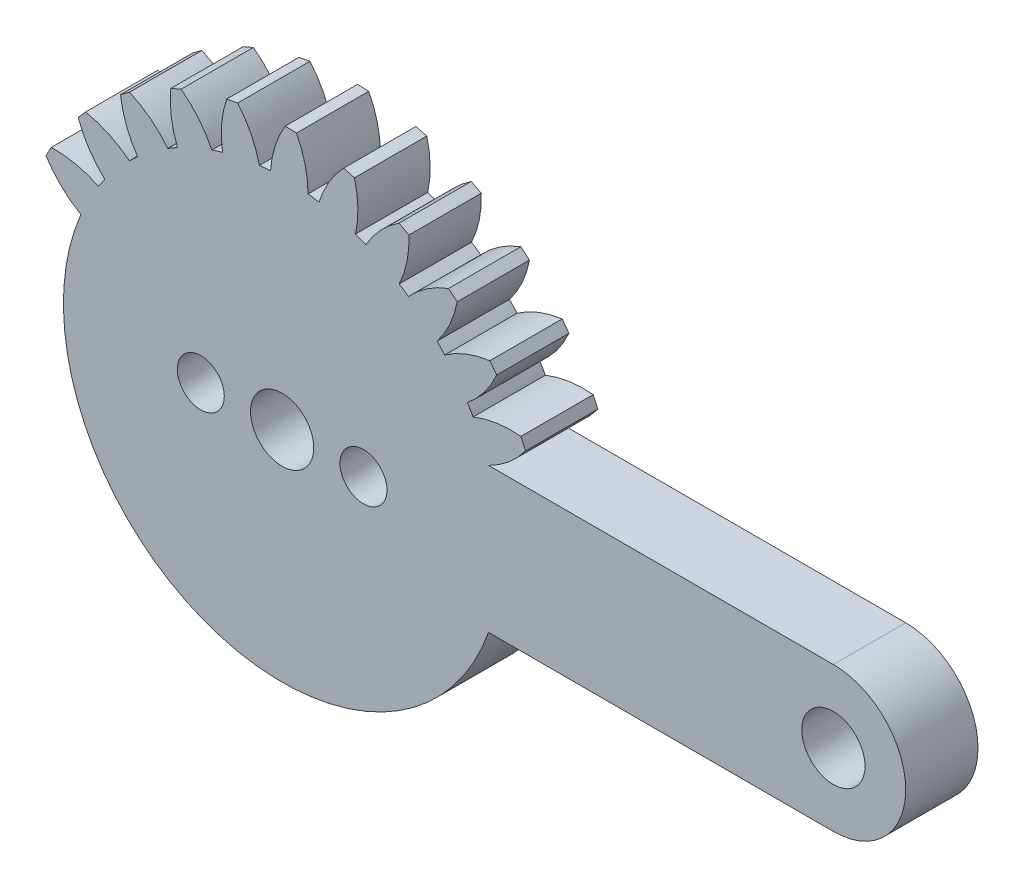
from build123d import *

# Parameters (mm, degrees)
SKETCH1_R           = 1.75
BOSS_EXTRUDE2_DEPTH = 4
SKETCH2_R           = 1.3
CUT_EXTRUDE1_DEPTH  = 10


with BuildPart() as part:
    # Sketch1 → Boss-Extrude2 (new body)
    # profile 1 of 12: a face of its own
    with BuildSketch(Plane.XY):
        with BuildLine():
            Line((30.5, -4), (11.419719786, -4))
            ThreePointArc((11.419719786, -4), (-12.1, 0), (11.419719786, 4))
            Line((11.419719786, 4), (30.5, 4))
            ThreePointArc((30.5, 4), (34.5, 0), (30.5, -4))
        make_face()
        Circle(SKETCH1_R, mode=Mode.SUBTRACT)
        with Locations((30.5, 0)):
            Circle(SKETCH1_R, mode=Mode.SUBTRACT)
    # profile 2 of 12: a face of its own
    with BuildSketch(Plane.XY):
        with BuildLine():
            ThreePointArc((2.04630572, 11.925713098), (3.062574606, 11.706008576), (4.056229837, 11.399868399))
            ThreePointArc((4.056229837, 11.399868399), (4.191789848, 12.739862338), (4.004557713, 14.073618088))
            Line((4.004557713, 14.073618088), (3.400741544, 14.231598069))
            ThreePointArc((3.400741544, 14.231598069), (2.585583316, 13.159679272), (2.04630572, 11.925713098))
        make_face()
    # profile 3 of 12: a face of its own
    with BuildSketch(Plane.XY):
        with BuildLine():
            ThreePointArc((-0.641917286, 12.082960821), (0.397776079, 12.093459976), (1.434532317, 12.014662585))
            ThreePointArc((1.434532317, 12.014662585), (1.27037575, 13.351454601), (0.792800193, 14.610772615))
            Line((0.792800193, 14.610772615), (0.168997044, 14.631297504))
            ThreePointArc((0.168997044, 14.631297504), (-0.388904138, 13.405638858), (-0.641917286, 12.082960821))
        make_face()
    # profile 4 of 12: a face of its own
    with BuildSketch(Plane.XY):
        with BuildLine():
            ThreePointArc((-3.071117398, 14.306350498), (-3.344130279, 12.987655382), (-3.298347959, 11.641773952))
            ThreePointArc((-3.298347959, 11.641773952), (-2.286723162, 11.881956791), (-1.258213497, 12.034404796))
            ThreePointArc((-1.258213497, 12.034404796), (-1.713956435, 13.301787393), (-2.458222459, 14.424297241))
            Line((-2.458222459, 14.424297241), (-3.071117398, 14.306350498))
        make_face()
    # profile 5 of 12: a face of its own
    with BuildSketch(Plane.XY):
        with BuildLine():
            ThreePointArc((-6.159128153, 13.272850751), (-6.133731183, 11.926430371), (-5.791420864, 10.624003218))
            ThreePointArc((-5.791420864, 10.624003218), (-4.857967527, 11.08197417), (-3.888643585, 11.458117257))
            ThreePointArc((-3.888643585, 11.458117257), (-4.613401246, 12.593320589), (-5.587496363, 13.523427559))
            Line((-5.587496363, 13.523427559), (-6.159128153, 13.272850751))
        make_face()
    # profile 6 of 12: a face of its own
    with BuildSketch(Plane.XY):
        with BuildLine():
            ThreePointArc((-8.942094855, 11.581984556), (-8.619545875, 10.274523276), (-7.997661209, 9.080055902))
            ThreePointArc((-7.997661209, 9.080055902), (-7.188610613, 9.733132972), (-6.326480245, 10.314341845))
            ThreePointArc((-6.326480245, 10.314341845), (-7.28435745, 11.261142529), (-8.440037507, 11.952781076))
            Line((-8.440037507, 11.952781076), (-8.942094855, 11.581984556))
        make_face()
    # profile 7 of 12: a face of its own
    with BuildSketch(Plane.XY):
        with BuildLine():
            ThreePointArc((-11.2821851, 9.317495695), (-10.67845904, 8.113748343), (-9.807800202, 7.086399311))
            ThreePointArc((-9.807800202, 7.086399311), (-9.163222316, 7.902237454), (-8.450984381, 8.659726496))
            ThreePointArc((-8.450984381, 8.659726496), (-9.594540202, 9.371232193), (-10.874567661, 9.790147432))
            Line((-10.874567661, 9.790147432), (-11.2821851, 9.317495695))
        make_face()
    # profile 8 of 12: a face of its own
    with BuildSketch(Plane.XY):
        with BuildLine():
            ThreePointArc((-13.06350089, 6.591537844), (-12.208498581, 5.551122593), (-11.13218682, 4.741773571))
            ThreePointArc((-11.13218682, 4.741773571), (-10.684005749, 5.67996665), (-10.15693536, 6.576219589))
            ThreePointArc((-10.15693536, 6.576219589), (-11.42953274, 7.017191451), (-12.770511491, 7.142635705))
            Line((-12.770511491, 7.142635705), (-13.06350089, 6.591537844))
        make_face()
    # profile 9 of 12: a face of its own
    with BuildSketch(Plane.XY):
        with BuildLine():
            ThreePointArc((4.633181039, 11.177818815), (5.575692546, 10.738791954), (6.47703386, 10.22047124))
            ThreePointArc((6.47703386, 10.22047124), (6.905596548, 11.497301024), (7.017980909, 12.839437391))
            Line((7.017980909, 12.839437391), (6.464057014, 13.127048167))
            ThreePointArc((6.464057014, 13.127048167), (5.432014202, 12.2619583), (4.633181039, 11.177818815))
        make_face()
    # profile 10 of 12: a face of its own
    with BuildSketch(Plane.XY):
        with BuildLine():
            ThreePointArc((6.990588114, 9.876319042), (7.812662335, 9.239713591), (8.577048867, 8.534883288))
            ThreePointArc((8.577048867, 8.534883288), (9.277388744, 9.685311177), (9.683823524, 10.969355975))
            Line((9.683823524, 10.969355975), (9.207226173, 11.372353004))
            ThreePointArc((9.207226173, 11.372353004), (8.009412915, 10.7569375), (6.990588114, 9.876319042))
        make_face()
    # profile 11 of 12: a face of its own
    with BuildSketch(Plane.XY):
        with BuildLine():
            ThreePointArc((9.001771295, 8.085673352), (9.662693238, 7.283018563), (10.252267103, 6.426586905))
            ThreePointArc((10.252267103, 6.426586905), (11.189698333, 7.393635488), (11.870053976, 8.555993639))
            Line((11.870053976, 8.555993639), (11.494387677, 9.054417628))
            ThreePointArc((11.494387677, 9.054417628), (10.190128247, 8.719156263), (9.001771295, 8.085673352))
        make_face()
    # profile 12 of 12: a face of its own
    with BuildSketch(Plane.XY):
        with BuildLine():
            ThreePointArc((10.567122415, 5.894567319), (11.034158501, 4.965616394), (11.419719786, 4))
            ThreePointArc((11.419719786, 4), (12.547814073, 4.735774119), (13.468394505, 5.718877338))
            Line((13.468394505, 5.718877338), (13.212264939, 6.288042768))
            ThreePointArc((13.212264939, 6.288042768), (11.866155587, 6.249540081), (10.567122415, 5.894567319))
        make_face()
    extrude(amount=BOSS_EXTRUDE2_DEPTH)

    # Sketch2 → Cut-Extrude1 (cut)
    with BuildSketch(Plane(origin=(0, 0, 0), x_dir=(-1, 0, 0), z_dir=(0, 0, -1))):
        with Locations((4.5, 0)):
            Circle(SKETCH2_R)
        with Locations((-4.5, 0)):
            Circle(SKETCH2_R)
    extrude(amount=-CUT_EXTRUDE1_DEPTH, mode=Mode.SUBTRACT)


solid = part.part
